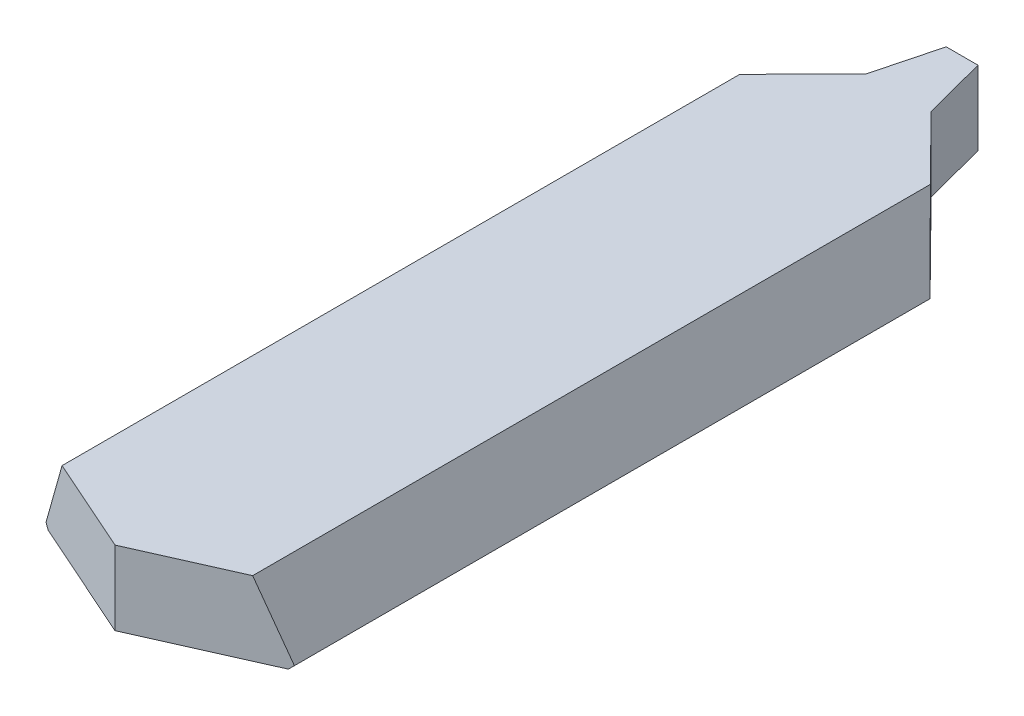
from build123d import *

# Parameters (mm, degrees)
BOSS_EXTRUDE1_START = -22
BOSS_EXTRUDE1_DEPTH = 80
SKETCH3_OUTSIDE_W   = 42.192
SKETCH3_OUTSIDE_H   = 98.732
CUT_EXTRUDE1_DEPTH  = 60.586928072


with BuildPart() as part:
    # Sketch2 → Boss-Extrude1 (new body)
    with BuildSketch(Plane.XY.offset(BOSS_EXTRUDE1_START)):
        Polygon((9, 0), (11.730387764, -6.607891004), (11.336920491, -7), (-11.336920491, -7), (-11.730387764, -6.607891004), (-9, 0), align=None)
    extrude(amount=BOSS_EXTRUDE1_DEPTH)

    # Sketch3 outside → Cut-Extrude1 (cut, through all)
    with BuildSketch(Plane(origin=(0, 0, 0), x_dir=(1, 0, 0), z_dir=(0, 1, 0))):
        with Locations((0, -18)):
            Rectangle(SKETCH3_OUTSIDE_W, SKETCH3_OUTSIDE_H)
        Polygon((-11.730387764, 7.23737522), (-3.070013885, 16), (-1.5, 22), (1.5, 22), (3.070013885, 16), (11.730387764, 7.23737522), (11.730387764, -52.786494327), (0, -58), (-11.730387764, -52.786494327), align=None, mode=Mode.SUBTRACT)
    extrude(amount=-CUT_EXTRUDE1_DEPTH, mode=Mode.SUBTRACT)


solid = part.part
